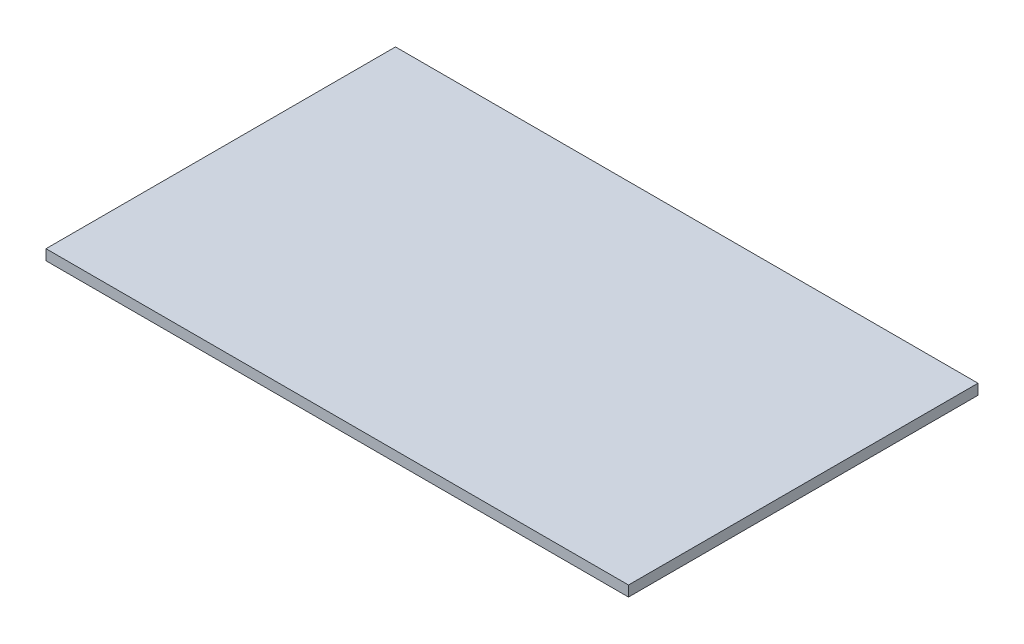
from build123d import *

# Parameters (mm, degrees)
SCHIZZO1_W                   = 1000
SCHIZZO1_H                   = 600
ESTRUSIONE_ESTRUSIONE1_DEPTH = 18


with BuildPart() as part:
    # Schizzo1 → Estrusione-Estrusione1 (new body)
    with BuildSketch(Plane(origin=(0, 0, 0), x_dir=(1, 0, 0), z_dir=(0, 1, 0))):
        Rectangle(SCHIZZO1_W, SCHIZZO1_H)
    extrude(amount=ESTRUSIONE_ESTRUSIONE1_DEPTH)


solid = part.part
